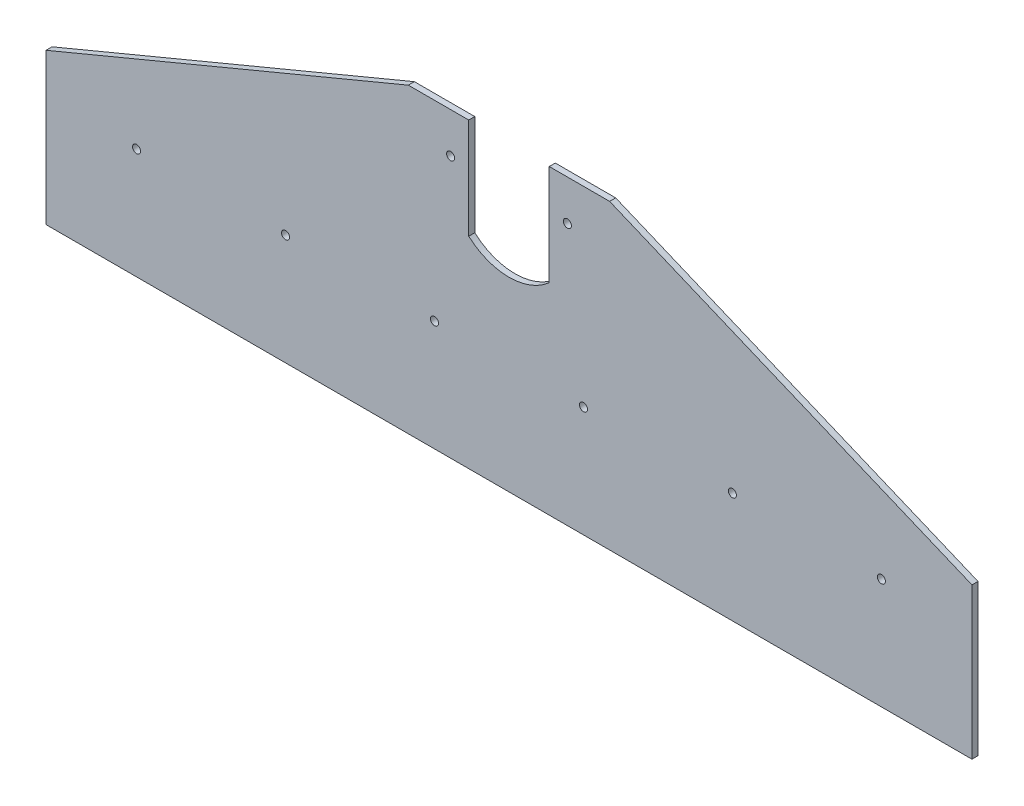
from build123d import *

# Parameters (mm, degrees)
Y_KSEKLIK_EKSTR_ZYON1_DEPTH = 3
IZIM2_R                     = 2
KES_EKSTR_ZYON1_DEPTH       = 3


with BuildPart() as part:
    # Çizim1 → Yükseklik-Ekstrüzyon1 (new body)
    with BuildSketch(Plane.XY):
        Polygon((0, 0), (460, 0), (460, 75), (280, 150), (180, 150), (0, 75), align=None)
    extrude(amount=Y_KSEKLIK_EKSTR_ZYON1_DEPTH)

    # Çizim2 → Kes-Ekstrüzyon1 (cut)
    with BuildSketch(Plane.XY.offset(3)):
        with Locations((45, 55)):
            Circle(IZIM2_R)
        with Locations((119, 55)):
            Circle(IZIM2_R)
        with Locations((193, 55)):
            Circle(IZIM2_R)
        with Locations((267, 55)):
            Circle(IZIM2_R)
        with Locations((341, 55)):
            Circle(IZIM2_R)
        with Locations((415, 55)):
            Circle(IZIM2_R)
        with Locations((201, 130)):
            Circle(IZIM2_R)
        with Locations((259, 130)):
            Circle(IZIM2_R)
        with BuildLine():
            Line((210, 150), (250, 150))
            Line((250, 150), (250, 100))
            ThreePointArc((250, 100), (230, 92.360679775), (210, 100))
            Line((210, 100), (210, 150))
        make_face()
    extrude(amount=-KES_EKSTR_ZYON1_DEPTH, mode=Mode.SUBTRACT)


solid = part.part
